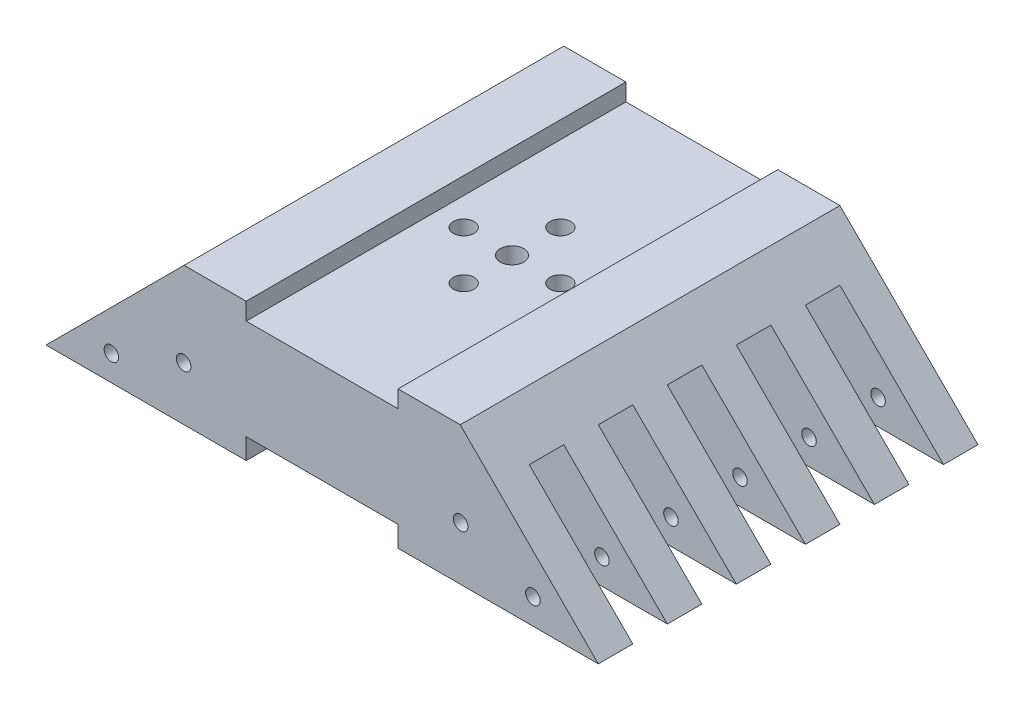
from build123d import *

# Parameters (mm, degrees)
SKETCH_1_R          = 1.05
EXTRUDE_1_DEPTH     = 55
SKETCH_2_W          = 51
SKETCH_2_H          = 5
CUT_EXTRUDE_1_DEPTH = 15
SKETCH_3_R          = 1.5
CUT_EXTRUDE_2_DEPTH = 15
SKETCH_4_W          = 20
SKETCH_4_H          = 21.363917142
CUT_EXTRUDE_3_DEPTH = 12


with BuildPart() as part:
    # 草图1 → 凸台-拉伸1 (new body)
    with BuildSketch(Plane.XY):
        Polygon((-11, 10), (-20, 10), (-40, -10), (-11, -10), (-11, -7), (11, -7), (11, -10), (40, -10), (20, 10), (11, 10), (11, 7.5), (-11, 7.5), align=None)
        with Locations((-30.525046877, -6.313107933)):
            Circle(SKETCH_1_R, mode=Mode.SUBTRACT)
        with Locations((-20.062564905, -2.241948818)):
            Circle(SKETCH_1_R, mode=Mode.SUBTRACT)
        with Locations((30.525046877, -6.313107933)):
            Circle(SKETCH_1_R, mode=Mode.SUBTRACT)
        with Locations((20.062564905, -2.241948818)):
            Circle(SKETCH_1_R, mode=Mode.SUBTRACT)
    extrude(amount=EXTRUDE_1_DEPTH)

    # 草图2 → 切除-拉伸1 (cut)
    with BuildSketch(Plane.XZ.offset(10)):
        Polygon((-40, 45), (-25.5, 45), (-11, 45), (-11, 50), (-25.5, 50), (-40, 50), align=None)
        with Locations((14.5, 47.5)):
            Rectangle(SKETCH_2_W, SKETCH_2_H)
        Polygon((-11, 40), (-25.5, 40), (-40, 40), (-40, 35), (-25.5, 35), (-11, 35), align=None)
        with Locations((14.5, 37.5)):
            Rectangle(SKETCH_2_W, SKETCH_2_H)
        Polygon((-25.5, 30), (-40, 30), (-40, 25), (-25.5, 25), (-11, 25), (-11, 30), align=None)
        with Locations((14.5, 27.5)):
            Rectangle(SKETCH_2_W, SKETCH_2_H)
        Polygon((-25.5, 20), (-40, 20), (-40, 15), (-25.5, 15), (-11, 15), (-11, 20), align=None)
        with Locations((14.5, 17.5)):
            Rectangle(SKETCH_2_W, SKETCH_2_H)
        Polygon((-25.5, 10), (-40, 10), (-40, 5), (-25.5, 5), (-11, 5), (-11, 10), align=None)
        with Locations((14.5, 7.5)):
            Rectangle(SKETCH_2_W, SKETCH_2_H)
    extrude(amount=-CUT_EXTRUDE_1_DEPTH, mode=Mode.SUBTRACT)

    # 草图3 → 切除-拉伸2 (cut)
    with BuildSketch(Plane(origin=(0, 7.5, 0), x_dir=(1, 0, 0), z_dir=(0, 1, 0))):
        with BuildLine():
            ThreePointArc((1.5, -20.5), (1.060660172, -19.439339828), (0, -19))
            Line((0, -19), (0, -22))
            ThreePointArc((0, -22), (1.060660172, -21.560660172), (1.5, -20.5))
        make_face()
        with BuildLine():
            Line((0, -22), (0, -19))
            ThreePointArc((0, -19), (-1.5, -20.5), (0, -22))
        make_face()
        with BuildLine():
            ThreePointArc((1.7, -27.5), (1.202081528, -26.297918472), (0, -25.8))
            Line((0, -25.8), (0, -29.2))
            ThreePointArc((0, -29.2), (1.202081528, -28.702081528), (1.7, -27.5))
        make_face()
        with BuildLine():
            Line((0, -29.2), (0, -25.8))
            ThreePointArc((0, -25.8), (-1.7, -27.5), (0, -29.2))
        make_face()
        with Locations(Location((-7, -27.5, 0), (0, 0, 270))):
            Circle(SKETCH_3_R)
        with Locations(Location((7, -27.5, 0), (0, 0, 270))):
            Circle(SKETCH_3_R)
        with BuildLine():
            ThreePointArc((1.5, -34.5), (1.060660172, -33.439339828), (0, -33))
            Line((0, -33), (0, -36))
            ThreePointArc((0, -36), (1.060660172, -35.560660172), (1.5, -34.5))
        make_face()
        with BuildLine():
            Line((0, -36), (0, -33))
            ThreePointArc((0, -33), (-1.5, -34.5), (0, -36))
        make_face()
    extrude(amount=-CUT_EXTRUDE_2_DEPTH, mode=Mode.SUBTRACT)

    # 草图4 → 切除-拉伸3 (cut)
    with BuildSketch(Plane.XZ.offset(7)):
        with Locations((0, 27.5)):
            Rectangle(SKETCH_4_W, SKETCH_4_H)
    extrude(amount=-CUT_EXTRUDE_3_DEPTH, mode=Mode.SUBTRACT)


solid = part.part
